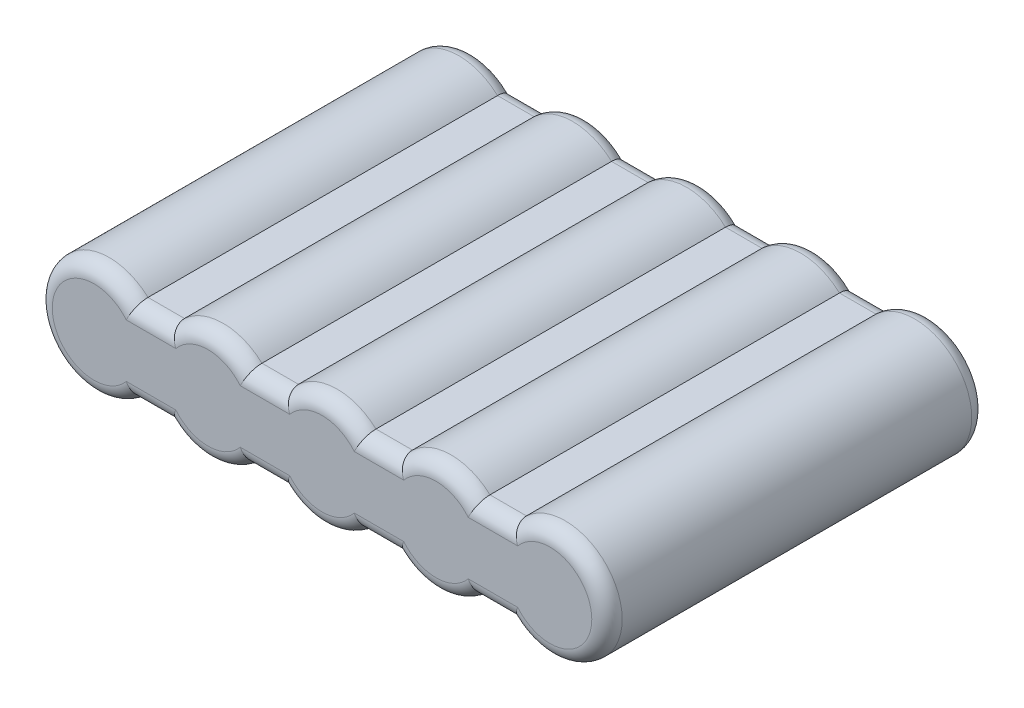
from build123d import *

# Parameters (mm, degrees)
SKETCH1_W           = 95.25
SKETCH1_H           = 63.5
BOSS_EXTRUDE1_DEPTH = 19.05
SKETCH2_OUTSIDE_W   = 120.46
SKETCH2_OUTSIDE_H   = 44.26
CUT_EXTRUDE1_DEPTH  = 117.050484704
FILLET1_R           = 2.54


with BuildPart() as part:
    # Sketch1 → Boss-Extrude1 (new body)
    with BuildSketch(Plane(origin=(0, 0, 0), x_dir=(1, 0, 0), z_dir=(0, 1, 0))):
        with Locations((47.625, -31.75)):
            Rectangle(SKETCH1_W, SKETCH1_H)
    extrude(amount=BOSS_EXTRUDE1_DEPTH)

    # Sketch2 outside → Cut-Extrude1 (cut, through all)
    with BuildSketch(Plane.XY.offset(63.5)):
        with Locations((47.625, 9.525)):
            Rectangle(SKETCH2_OUTSIDE_W, SKETCH2_OUTSIDE_H)
        with BuildLine():
            Line((16.000754782, 16.51), (22.099245218, 16.51))
            ThreePointArc((22.099245218, 16.51), (28.575, 19.05), (35.050754782, 16.51))
            Line((35.050754782, 16.51), (41.149245218, 16.51))
            ThreePointArc((41.149245218, 16.51), (47.625, 19.05), (54.100754782, 16.51))
            Line((54.100754782, 16.51), (60.199245218, 16.51))
            ThreePointArc((60.199245218, 16.51), (66.675, 19.05), (73.150754782, 16.51))
            Line((73.150754782, 16.51), (79.249245218, 16.51))
            ThreePointArc((79.249245218, 16.51), (95.25, 9.525), (79.249245218, 2.54))
            Line((79.249245218, 2.54), (73.150754782, 2.54))
            ThreePointArc((73.150754782, 2.54), (66.675, 0), (60.199245218, 2.54))
            Line((60.199245218, 2.54), (54.100754782, 2.54))
            ThreePointArc((54.100754782, 2.54), (47.625, 0), (41.149245218, 2.54))
            Line((41.149245218, 2.54), (35.050754782, 2.54))
            ThreePointArc((35.050754782, 2.54), (28.575, 0), (22.099245218, 2.54))
            Line((22.099245218, 2.54), (16.000754782, 2.54))
            ThreePointArc((16.000754782, 2.54), (0, 9.525), (16.000754782, 16.51))
        make_face(mode=Mode.SUBTRACT)
    extrude(amount=-CUT_EXTRUDE1_DEPTH, mode=Mode.SUBTRACT)

    # Fillet1
    fillet1_edges = [part.edges().sort_by_distance(p)[0] for p in [
        (28.575, 19.05, 0),
        (47.625, 19.05, 0),
        (66.675, 19.05, 0),
        (0, 9.525, 0),
        (95.25, 9.525, 0),
        (66.675, 0, 0),
        (47.625, 0, 0),
        (28.575, 0, 0),
        (19.05, 16.51, 63.5),
        (38.1, 16.51, 63.5),
        (57.15, 16.51, 63.5),
        (76.2, 16.51, 63.5),
        (76.2, 2.54, 0),
        (57.15, 2.54, 0),
        (38.1, 2.54, 0),
        (19.05, 2.54, 0),
        (19.05, 16.51, 0),
        (38.1, 16.51, 0),
        (57.15, 16.51, 0),
        (76.2, 16.51, 0),
        (0, 9.525, 63.5),
        (19.05, 2.54, 63.5),
        (28.575, 0, 63.5),
        (38.1, 2.54, 63.5),
        (47.625, 0, 63.5),
        (57.15, 2.54, 63.5),
        (66.675, 0, 63.5),
        (76.2, 2.54, 63.5),
        (95.25, 9.525, 63.5),
        (66.675, 19.05, 63.5),
        (47.625, 19.05, 63.5),
        (28.575, 19.05, 63.5),
    ]]
    fillet(fillet1_edges, radius=FILLET1_R)


solid = part.part
